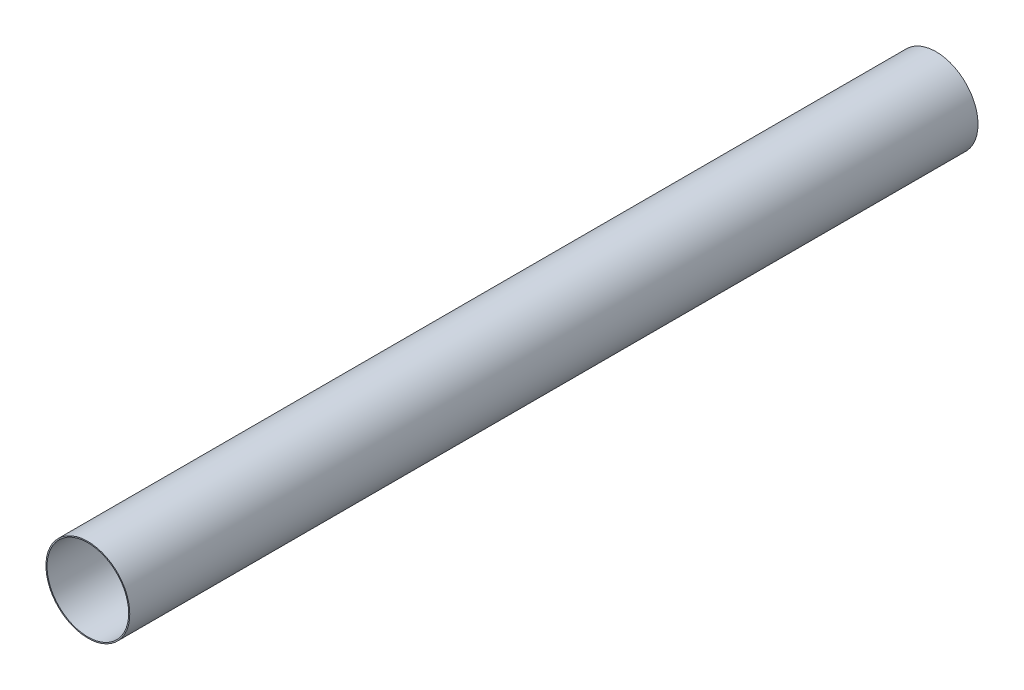
from build123d import *

# Parameters (mm, degrees)
SKETCH2_R           = 56.5
SKETCH2_R_2         = 55
BOSS_EXTRUDE1_DEPTH = 1143


with BuildPart() as part:
    # Sketch2 → Boss-Extrude1 (new body)
    with BuildSketch(Plane.XY):
        Circle(SKETCH2_R)
        Circle(SKETCH2_R_2, mode=Mode.SUBTRACT)
    extrude(amount=BOSS_EXTRUDE1_DEPTH)


solid = part.part
